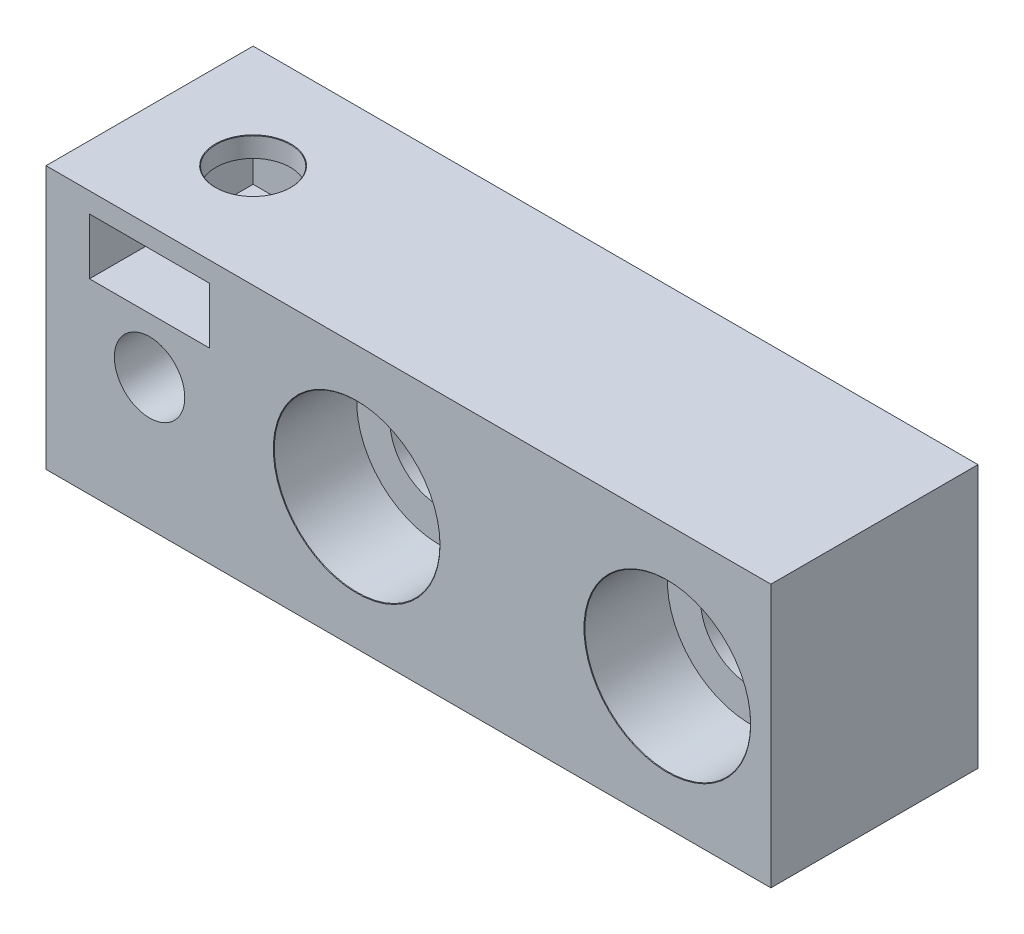
from build123d import *

# Parameters (mm, degrees)
SKETCH1_W                      = 35
SKETCH1_H                      = 12.7
BOSS_EXTRUDE1_DEPTH            = 10
CBORE_FOR_M4_SHCS1_AT_2_COUNT  = 2
CBORE_FOR_M4_SHCS1_AT_2_PITCH  = 15
SKETCH4_R                      = 1.7
CUT_EXTRUDE1_DEPTH             = 10
M3_CLEARANCE_HOLE1_D           = 3.6
M3_CLEARANCE_HOLE1_DEPTH       = 5.918450886
M3_CLEARANCE_HOLE1_CSINK_D     = 3.65
M3_CLEARANCE_HOLE1_CSINK_ANGLE = 100
M3_CLEARANCE_HOLE1_TIP         = 1.081549114
SKETCH7_W                      = 5.8
SKETCH7_H                      = 2.71
CUT_EXTRUDE2_DEPTH             = 7.9


with BuildPart() as part:
    # Sketch1 → Boss-Extrude1 (new body)
    with BuildSketch(Plane.XY):
        Rectangle(SKETCH1_W, SKETCH1_H)
    extrude(amount=BOSS_EXTRUDE1_DEPTH)

    # Sketch3 → CBORE for M4 SHCS1 (revolve, cut)
    with BuildSketch(Plane(origin=(12.5, 0, 10), x_dir=(0, -1, 0), z_dir=(1, 0, 0))):
        Polygon((0, 0), (0, 10), (2.4, 10), (2.4, 4), (4, 4), (4, 0.020977491), (4.025, 0), align=None)
    cbore_for_m4_shcs1 = revolve(axis=Axis((12.5, 0, 16.35), (0, 0, -1)), mode=Mode.SUBTRACT)

    # CBORE for M4 SHCS1 at 2: CBORE for M4 SHCS1 ×2
    with Locations(*[(-i * CBORE_FOR_M4_SHCS1_AT_2_PITCH, 0, 0) for i in range(1, CBORE_FOR_M4_SHCS1_AT_2_COUNT)]):
        add(cbore_for_m4_shcs1, mode=Mode.SUBTRACT)

    # Sketch4 → Cut-Extrude1 (cut)
    with BuildSketch(Plane.XY.offset(10)):
        with Locations((-12.5, 0)):
            Circle(SKETCH4_R)
    extrude(amount=-CUT_EXTRUDE1_DEPTH, mode=Mode.SUBTRACT)

    # M3 Clearance Hole1
    with Locations(Plane(origin=(0, 6.35, 0), x_dir=(1, 0, 0), z_dir=(0, 1, 0))):
        with Locations((-12.5, -5)):
            CounterSinkHole(M3_CLEARANCE_HOLE1_D / 2, M3_CLEARANCE_HOLE1_CSINK_D / 2, depth=M3_CLEARANCE_HOLE1_DEPTH, counter_sink_angle=M3_CLEARANCE_HOLE1_CSINK_ANGLE)
            with Locations((0, 0, -(M3_CLEARANCE_HOLE1_DEPTH + M3_CLEARANCE_HOLE1_TIP / 2))):  # 118° drill point
                Cone(0, M3_CLEARANCE_HOLE1_D / 2, M3_CLEARANCE_HOLE1_TIP, mode=Mode.SUBTRACT)

    # Sketch7 → Cut-Extrude2 (cut)
    with BuildSketch(Plane.XY.offset(10)):
        with Locations((-12.5, 4.025)):
            Rectangle(SKETCH7_W, SKETCH7_H)
    extrude(amount=-CUT_EXTRUDE2_DEPTH, mode=Mode.SUBTRACT)


solid = part.part
